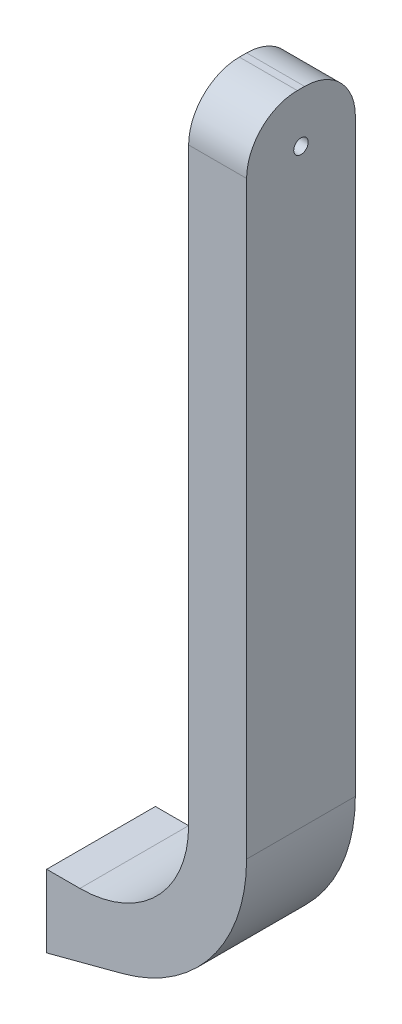
from build123d import *

# Parameters (mm, degrees)
BOSS_EXTRUDE1_DEPTH = 15
FILLET1_R           = 7
SKETCH2_R           = 1
CUT_EXTRUDE1_DEPTH  = 8


with BuildPart() as part:
    # Sketch1 → Boss-Extrude1 (new body)
    with BuildSketch(Plane.XY):
        with BuildLine():
            Line((96.814228499, 422.253610621), (101.396155955, 422.253610621))
            ThreePointArc((101.396155955, 422.253610621), (112.002757673, 426.647008903), (116.396155955, 437.253610621))
            Line((116.396155955, 437.253610621), (116.396155955, 525.576232013))
            Line((116.396155955, 525.576232013), (124.396155955, 525.576232013))
            Line((124.396155955, 525.576232013), (124.396155955, 437.253610621))
            ThreePointArc((124.396155955, 437.253610621), (119.618915568, 423.220398868), (107.271718381, 415.016754589))
            Line((107.271718381, 415.016754589), (96.814228499, 412.253610621))
            Line((96.814228499, 412.253610621), (96.814228499, 422.253610621))
        make_face()
    extrude(amount=-BOSS_EXTRUDE1_DEPTH)

    # Fillet1
    fillet1_edges = [part.edges().sort_by_distance(p)[0] for p in [
        (120.396155955, 525.576232013, -15),
        (120.396155955, 525.576232013, 0),
    ]]
    fillet(fillet1_edges, radius=FILLET1_R)

    # Sketch2 → Cut-Extrude1 (cut)
    with BuildSketch(Plane.ZY.offset(-116.396155955)):
        with Locations((-7.5, 518.676232013)):
            Circle(SKETCH2_R)
    extrude(amount=-CUT_EXTRUDE1_DEPTH, mode=Mode.SUBTRACT)


solid = part.part
